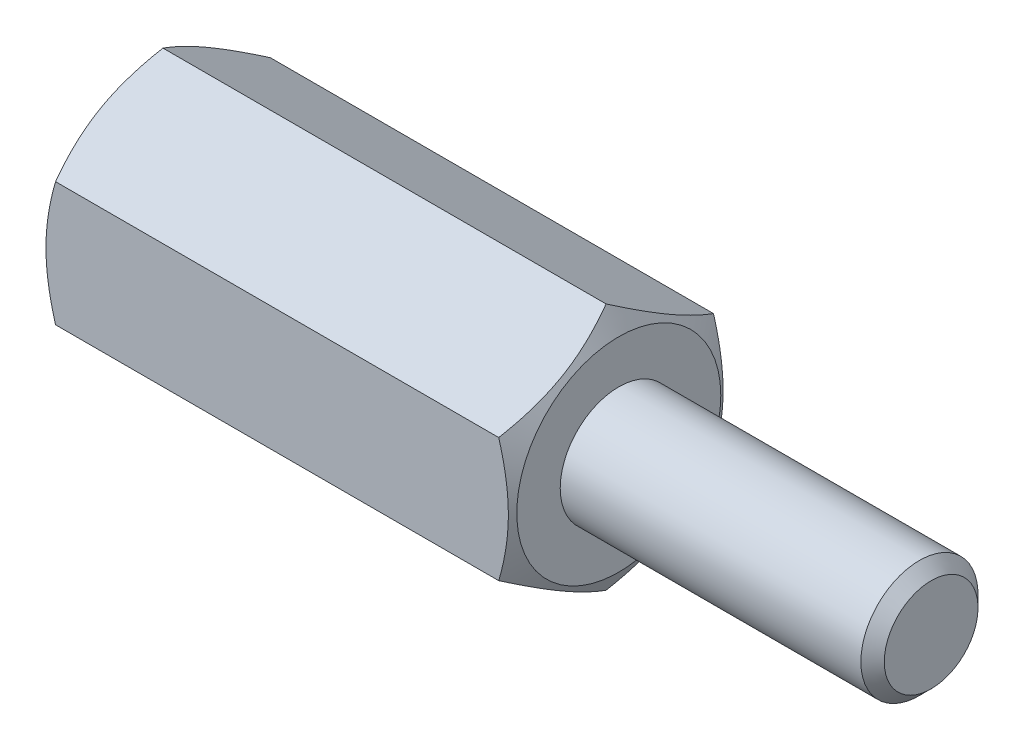
from build123d import *

# Parameters (mm, degrees)
BOSS_EXTRUDE1_DEPTH = 12
SKETCH2_R           = 1.5
BOSS_EXTRUDE2_DEPTH = 8
SKETCH3_R           = 1.5
CUT_EXTRUDE1_DEPTH  = 8
CHAMFER1_SIZE       = 0.3


with BuildPart() as part:
    # Sketch1 → Boss-Extrude1 (new body)
    with BuildSketch(Plane(origin=(0, 0, 0), x_dir=(0, 0, -1), z_dir=(1, 0, 0))):
        Polygon((0, 3.175426481), (-2.75, 1.58771324), (-2.75, -1.58771324), (0, -3.175426481), (2.75, -1.58771324), (2.75, 1.58771324), align=None)
    extrude(amount=BOSS_EXTRUDE1_DEPTH)

    # Sketch2 → Boss-Extrude2 (add)
    with BuildSketch(Plane(origin=(12, 0, 0), x_dir=(0, 0, -1), z_dir=(1, 0, 0))):
        Circle(SKETCH2_R)
    extrude(amount=BOSS_EXTRUDE2_DEPTH)

    # Sketch3 → Cut-Extrude1 (cut)
    with BuildSketch(Plane.ZY):
        with Locations(Location((0, 0, 0), (0, 0, 180))):
            Circle(SKETCH3_R)
    extrude(amount=-CUT_EXTRUDE1_DEPTH, mode=Mode.SUBTRACT)

    # Sketch4 → Cut-Revolve1 (revolve, cut)
    with BuildSketch(Plane(origin=(0, 0, 0), x_dir=(1, 0, 0), z_dir=(0, 1, 0)), mode=Mode.PRIVATE) as cut_revolve1_sk:
        Polygon((0, 10.219809024), (4.392081913, 10.219809024), (0, 2.6125), align=None)
        Polygon((12, 2.6125), (12, 10.219809024), (7.607918087, 10.219809024), align=None)
    revolve(cut_revolve1_sk.sketch.rotate(Axis((0, 0, 0), (-1, 0, 0)), 210.000000006), axis=Axis((0, 0, 0), (-1, 0, 0)), mode=Mode.SUBTRACT)

    # Chamfer1
    chamfer1_edges = [part.edges().sort_by_distance(p)[0] for p in [
        (20, 0, 1.5),
    ]]
    chamfer(chamfer1_edges, length=CHAMFER1_SIZE)


solid = part.part
